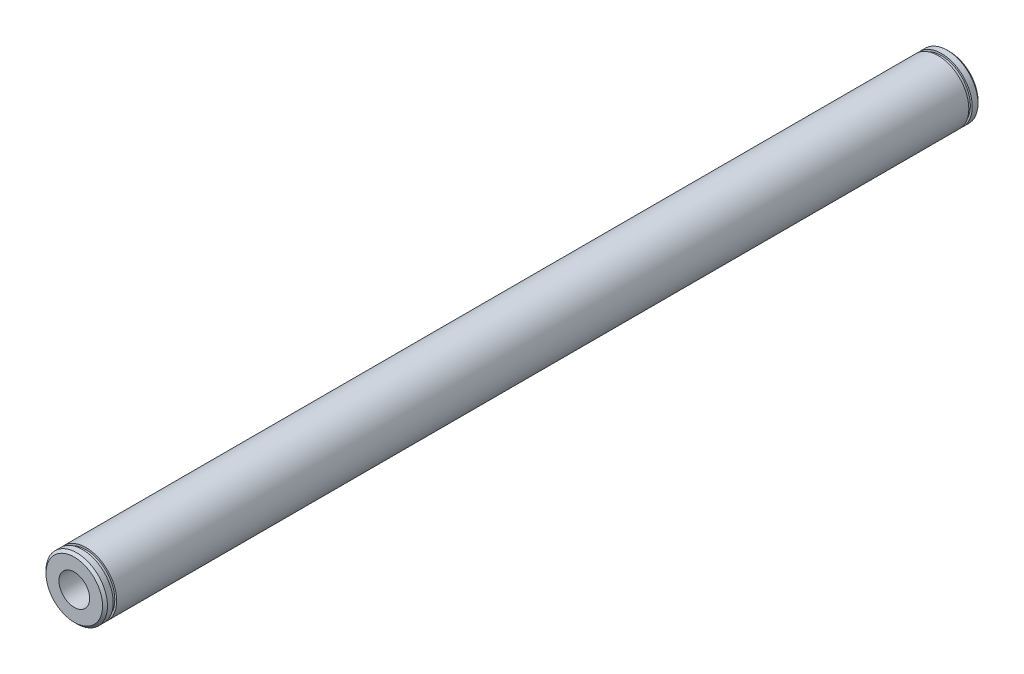
from build123d import *

# Parameters (mm, degrees)
SKETCH1_R                = 9.525
SKETCH1_R_2              = 4.7498
BOSS_EXTRUDE1_DEPTH      = 131.953
SKETCH2_R                = 8.9408
SKETCH2_R_2              = 4.7498
BOSS_EXTRUDE2_DEPTH      = 1.0668
SKETCH4_R                = 9.525
SKETCH4_R_2              = 4.7498
BOSS_EXTRUDE4_DEPTH      = 2.54
CHAMFER1_SIZE            = 0.762
CHAMFER1_OF_MIRROR1_SIZE = 0.762


with BuildPart() as part:
    # Sketch1 → Boss-Extrude1 (new, symmetric)
    with BuildSketch(Plane.XY):
        Circle(SKETCH1_R)
        Circle(SKETCH1_R_2, mode=Mode.SUBTRACT)
    extrude(amount=BOSS_EXTRUDE1_DEPTH, both=True)

    # Sketch2 → Boss-Extrude2 (add)
    with BuildSketch(Plane.XY.offset(131.953)):
        Circle(SKETCH2_R)
        Circle(SKETCH2_R_2, mode=Mode.SUBTRACT)
    boss_extrude2 = extrude(amount=BOSS_EXTRUDE2_DEPTH)

    # Sketch4 → Boss-Extrude4 (add)
    with BuildSketch(Plane.XY.offset(133.0198)):
        Circle(SKETCH4_R)
        Circle(SKETCH4_R_2, mode=Mode.SUBTRACT)
    boss_extrude4 = extrude(amount=BOSS_EXTRUDE4_DEPTH)

    # Chamfer1
    chamfer1_edges = [part.edges().sort_by_distance(p)[0] for p in [
        (-9.525, 0, 135.5598),
    ]]
    chamfer(chamfer1_edges, length=CHAMFER1_SIZE)

    # Mirror1: Boss-Extrude2, Boss-Extrude4 across plane
    add(boss_extrude2.mirror(Plane.XY))
    add(boss_extrude4.mirror(Plane.XY))

    # Chamfer1 of Mirror1
    chamfer1_of_mirror1_edges = [part.edges().sort_by_distance(p)[0] for p in [
        (-9.525, 0, -135.5598),
    ]]
    chamfer(chamfer1_of_mirror1_edges, length=CHAMFER1_OF_MIRROR1_SIZE)


solid = part.part
